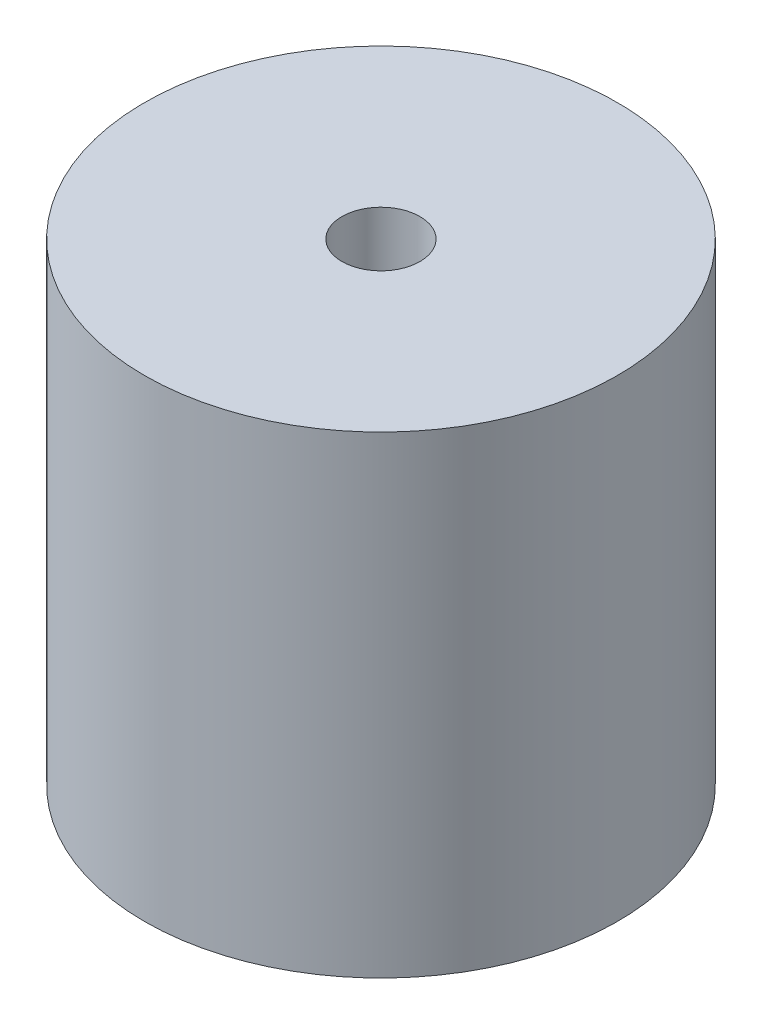
from build123d import *

# Parameters (mm, degrees)
SKETCH_1_R      = 100
SKETCH_1_R_2    = 16.5
EXTRUDE_1_DEPTH = 200


with BuildPart() as part:
    # 草图1 → 凸台-拉伸1 (new body)
    with BuildSketch(Plane(origin=(0, 0, 0), x_dir=(1, 0, 0), z_dir=(0, 1, 0))):
        with Locations(Location((0, 0, 0), (0, 0, 270))):
            Circle(SKETCH_1_R)
        with Locations(Location((0, 0, 0), (0, 0, 270))):
            Circle(SKETCH_1_R_2, mode=Mode.SUBTRACT)
    extrude(amount=EXTRUDE_1_DEPTH)


solid = part.part
